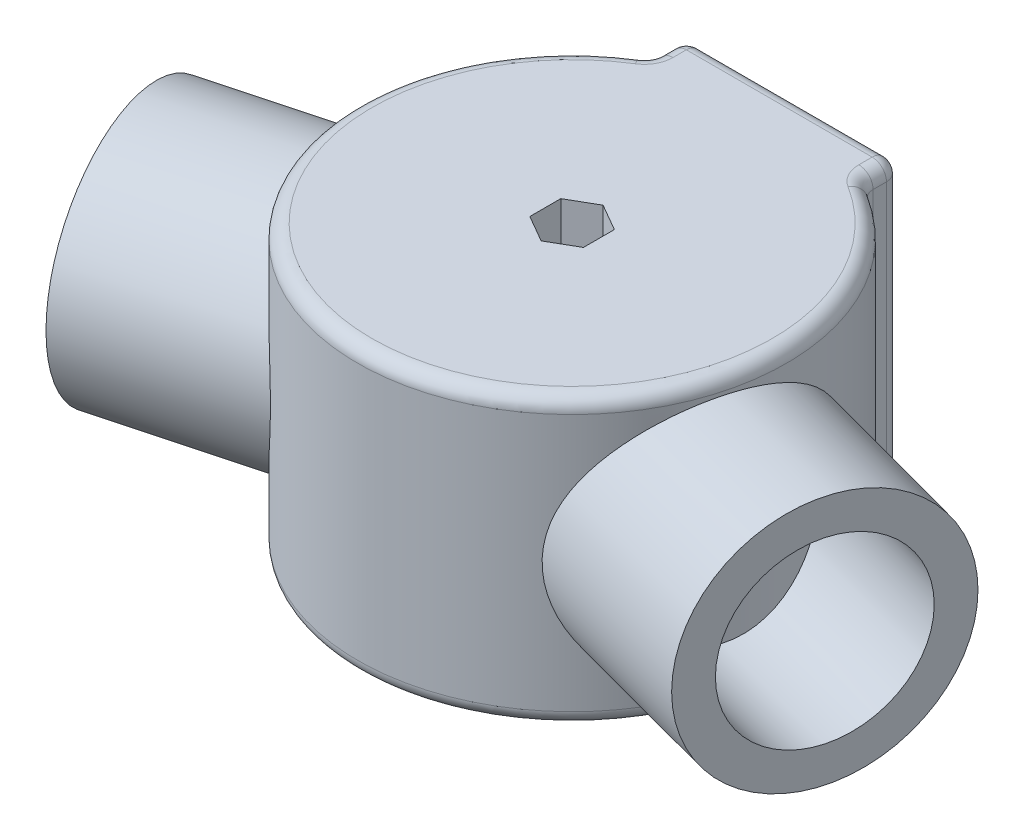
from build123d import *

# Parameters (mm, degrees)
SKETCH1_R           = 38.1
SKETCH1_W           = 38.1
SKETCH1_H           = 6.35
BOSS_EXTRUDE1_DEPTH = 25.4
BOSS_EXTRUDE2_START = -25.4
SKETCH3_R           = 22.225
SKETCH3_R_2         = 15.875
BOSS_EXTRUDE2_DEPTH = 33.655
FILLET1_R           = 2.54


with BuildPart() as part:
    # Sketch1 → Boss-Extrude1 (new, symmetric)
    # profile 1 of 2: a face of its own
    with BuildSketch(Plane(origin=(0, 0, 0), x_dir=(1, 0, 0), z_dir=(0, 1, 0))):
        Circle(SKETCH1_R)
        Polygon((0, -5.499261314), (4.7625, -2.749630657), (4.7625, 2.749630657), (0, 5.499261314), (-4.7625, 2.749630657), (-4.7625, -2.749630657), align=None, mode=Mode.SUBTRACT)
    # profile 2 of 2: a face of its own
    with BuildSketch(Plane(origin=(0, 0, 0), x_dir=(1, 0, 0), z_dir=(0, 1, 0))):
        with Locations((0, 36.170567884)):
            Rectangle(SKETCH1_W, SKETCH1_H)
    extrude(amount=BOSS_EXTRUDE1_DEPTH, both=True)

    # Sketch3 → Boss-Extrude2 (add)
    with BuildSketch(Plane(origin=(36.801773982, 0, 9.861005618), x_dir=(-0.2588190451025214, 0, 0.9659258262890681), z_dir=(-0.9659258262890681, 0, -0.2588190451025214)).offset(BOSS_EXTRUDE2_START)):
        with Locations(Location((0, 0, 0), (0, 0, 180))):
            Circle(SKETCH3_R)
        with Locations(Location((0, 0, 0), (0, 0, 180))):
            Circle(SKETCH3_R_2, mode=Mode.SUBTRACT)
    boss_extrude2 = extrude(amount=BOSS_EXTRUDE2_DEPTH)

    # Mirror1: Boss-Extrude2 across plane
    add(boss_extrude2.mirror(Plane(origin=(0, 0, 0), x_dir=(0, 0, 1), z_dir=(1, 0, 0))))

    # Fillet1
    fillet1_edges = [part.edges().sort_by_distance(p)[0] for p in [
        (19.05, 25.4, -36.170567884),
        (0, -25.4, -39.345567884),
        (19.05, -25.4, -36.170567884),
        (0, -25.4, 38.1),
        (-19.05, -25.4, -36.170567884),
        (0, 25.4, -39.345567884),
        (-19.05, 0, -39.345567884),
        (19.05, 0, -39.345567884),
        (19.05, 0, -32.995567884),
        (-19.05, 0, -32.995567884),
        (-19.05, 25.4, -36.170567884),
        (0, 25.4, 38.1),
    ]]
    fillet(fillet1_edges, radius=FILLET1_R)


solid = part.part
